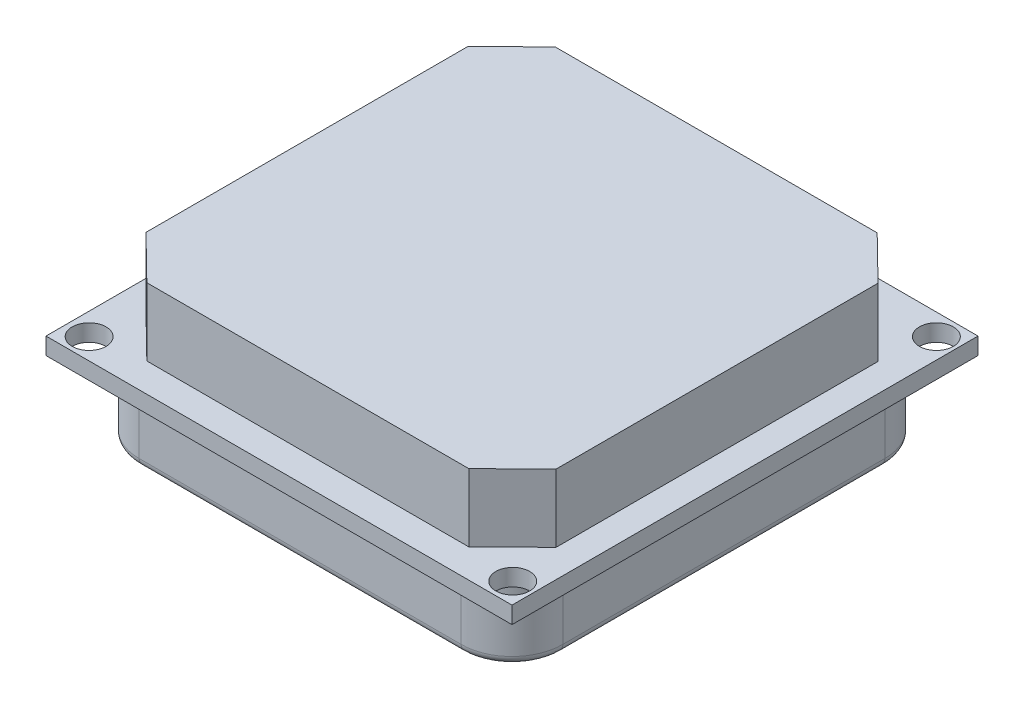
from build123d import *

# Parameters (mm, degrees)
SKETCH_1_W          = 27.5
SKETCH_1_H          = 27.5
EXTRUDE_1_DEPTH     = 1
SKETCH_2_R          = 1
CUT_EXTRUDE_1_DEPTH = 1
EXTRUDE_2_DEPTH     = 4
EXTRUDE_3_DEPTH     = 4.26
SKETCH_5_R          = 1.6
EXTRUDE_4_DEPTH     = 0.3
FILLET_1_R          = 0.5


with BuildPart() as part:
    # 草图1 → 凸台-拉伸1 (new body)
    with BuildSketch(Plane(origin=(0, 0, 0), x_dir=(1, 0, 0), z_dir=(0, 1, 0))):
        Rectangle(SKETCH_1_W, SKETCH_1_H)
    extrude(amount=EXTRUDE_1_DEPTH)

    # 草图2 → 切除-拉伸1 (cut)
    with BuildSketch(Plane(origin=(0, 1, 0), x_dir=(1, 0, 0), z_dir=(0, 1, 0))):
        with Locations(Location((-12.447971734, 12.492096903, 0), (0, 0, 270))):
            Circle(SKETCH_2_R)
        with Locations(Location((12.552028266, 12.492096903, 0), (0, 0, 270))):
            Circle(SKETCH_2_R)
        with Locations(Location((12.552028266, -12.507903097, 0), (0, 0, 270))):
            Circle(SKETCH_2_R)
        with Locations(Location((-12.447971734, -12.507903097, 0), (0, 0, 270))):
            Circle(SKETCH_2_R)
    extrude(amount=-CUT_EXTRUDE_1_DEPTH, mode=Mode.SUBTRACT)

    # 草图3 → 凸台-拉伸2 (add)
    with BuildSketch(Plane(origin=(0, 1, 0), x_dir=(1, 0, 0), z_dir=(0, 1, 0))):
        Polygon((-9.5, 12.05), (-12.1, 9.5), (-12.1, -9.5), (-9.5, -12.05), (9.5, -12.05), (12.1, -9.5), (12.1, 9.5), (9.5, 12.05), align=None)
    extrude(amount=EXTRUDE_2_DEPTH)

    # 草图4 → 凸台-拉伸3 (add)
    with BuildSketch(Plane.XZ):
        with BuildLine():
            Line((-9.5, 12.5), (9.5, 12.5))
            ThreePointArc((9.5, 12.5), (11.621320344, 11.621320344), (12.5, 9.5))
            Line((12.5, 9.5), (12.5, -9.5))
            ThreePointArc((12.5, -9.5), (11.621320344, -11.621320344), (9.5, -12.5))
            Line((9.5, -12.5), (-9.5, -12.5))
            ThreePointArc((-9.5, -12.5), (-11.621320344, -11.621320344), (-12.5, -9.5))
            Line((-12.5, -9.5), (-12.5, 9.5))
            ThreePointArc((-12.5, 9.5), (-11.621320344, 11.621320344), (-9.5, 12.5))
        make_face()
    extrude(amount=EXTRUDE_3_DEPTH)

    # 草图5 → 凸台-拉伸4 (add)
    with BuildSketch(Plane.XZ.offset(4.26)):
        with Locations(Location((2.5, 0.5, 0), (0, 0, 270))):
            Circle(SKETCH_5_R)
    extrude(amount=EXTRUDE_4_DEPTH)

    # 圆角1
    fillet_1_edges = [part.edges().sort_by_distance(p)[0] for p in [
        (-11.621320344, -4.26, 11.621320344),
        (-12.5, -4.26, 0),
        (-11.621320344, -4.26, -11.621320344),
        (0, -4.26, -12.5),
        (11.621320344, -4.26, -11.621320344),
        (12.5, -4.26, 0),
        (11.621320344, -4.26, 11.621320344),
        (0, -4.26, 12.5),
    ]]
    fillet(fillet_1_edges, radius=FILLET_1_R)


solid = part.part
